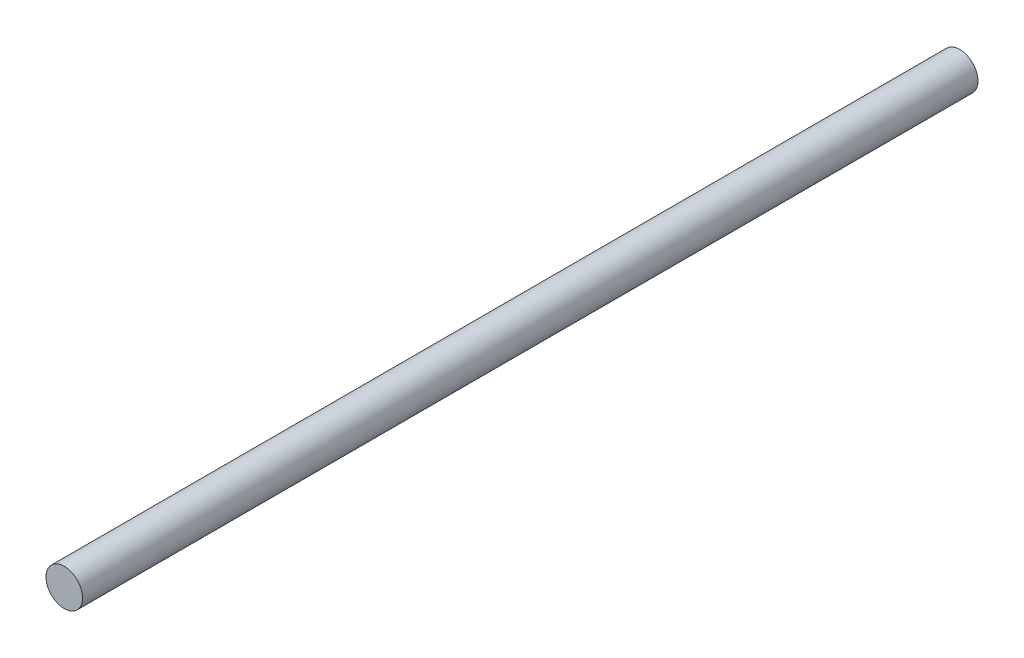
from build123d import *

# Parameters (mm, degrees)
SKETCH1_R           = 6.75
BOSS_EXTRUDE1_DEPTH = 330


with BuildPart() as part:
    # Sketch1 → Boss-Extrude1 (new body)
    with BuildSketch(Plane.XY):
        Circle(SKETCH1_R)
    extrude(amount=BOSS_EXTRUDE1_DEPTH)


solid = part.part
